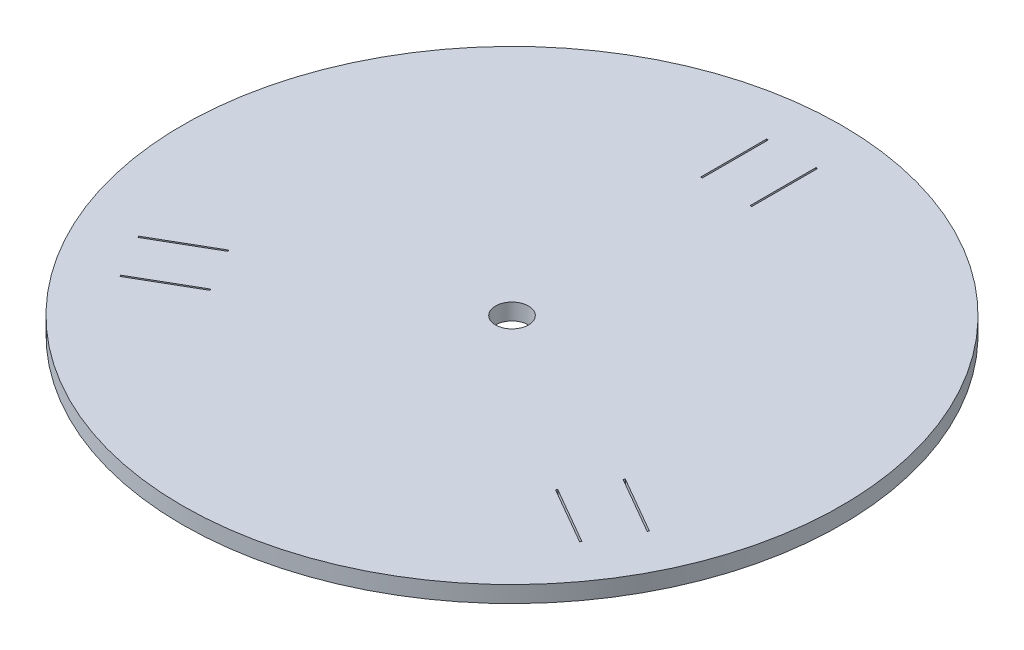
from build123d import *

# Parameters (mm, degrees)
SKETCH2_R           = 100
BOSS_EXTRUDE1_DEPTH = 5
SKETCH3_W           = 0.5
SKETCH3_H           = 20
CUT_EXTRUDE1_DEPTH  = 142.509716981


with BuildPart() as part:
    # Sketch2 → Boss-Extrude1 (new body)
    with BuildSketch(Plane(origin=(0, 0, 0), x_dir=(1, 0, 0), z_dir=(0, 1, 0))):
        with Locations(Location((0, 0, 0), (0, 0, 270))):
            Circle(SKETCH2_R)
    extrude(amount=BOSS_EXTRUDE1_DEPTH)

    # Sketch3 → Cut-Extrude1 (cut, through all)
    with BuildSketch(Plane(origin=(0, 5, 0), x_dir=(1, 0, 0), z_dir=(0, 1, 0))):
        with Locations((-7.5, 75)):
            Rectangle(SKETCH3_W, SKETCH3_H)
        with Locations((7.5, 75)):
            Rectangle(SKETCH3_W, SKETCH3_H)
        Polygon((60.166651246, -25.788303121), (77.487159322, -35.788303121), (77.237159322, -36.221315823), (59.916651246, -26.221315823), align=None)
        Polygon((52.666651246, -38.778684177), (69.987159322, -48.778684177), (69.737159322, -49.211696879), (52.416651246, -39.211696879), align=None)
        Polygon((-52.416651246, -39.211696879), (-69.737159322, -49.211696879), (-69.987159322, -48.778684177), (-52.666651246, -38.778684177), align=None)
        Polygon((-59.916651246, -26.221315823), (-77.237159322, -36.221315823), (-77.487159322, -35.788303121), (-60.166651246, -25.788303121), align=None)
    extrude(amount=-CUT_EXTRUDE1_DEPTH, mode=Mode.SUBTRACT)

    # Sketch7 → Ø10.0mm Dowel Hole1 (revolve, cut)
    with BuildSketch(Plane(origin=(0, 0, 0), x_dir=(0, 0, -1), z_dir=(1, 0, 0))):
        Polygon((0, 0), (0, 5), (5, 5), (5, 0.025), (5.025, 0), align=None)
    revolve(axis=Axis((0, -6.35, 0), (0, 1, 0)), mode=Mode.SUBTRACT)


solid = part.part
